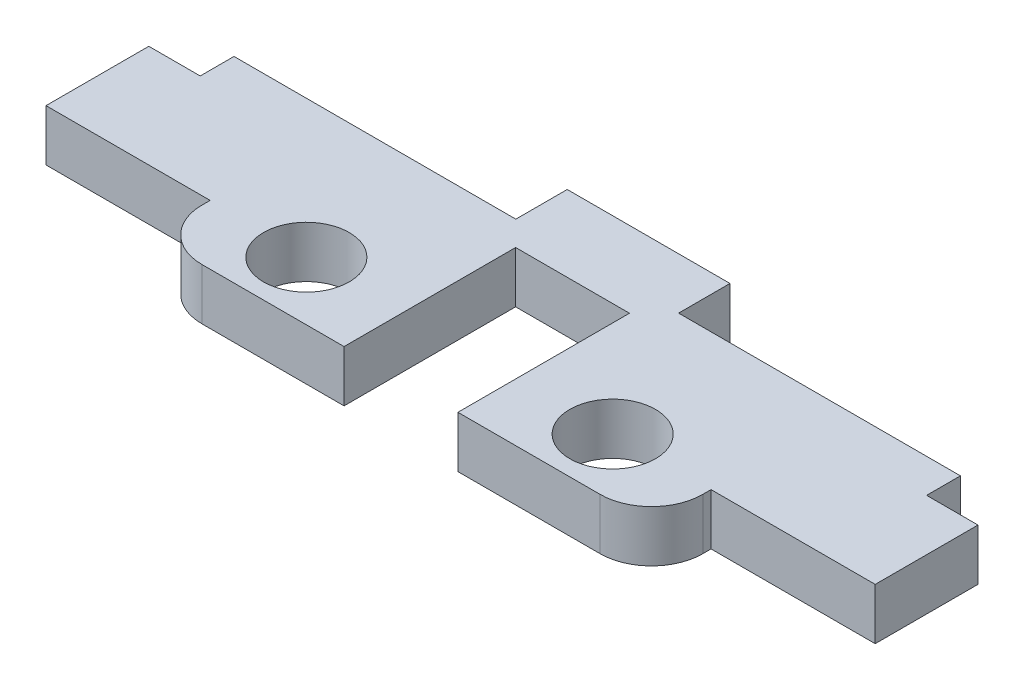
from build123d import *

# Parameters (mm, degrees)
SKETCH1_R           = 5
BOSS_EXTRUDE1_DEPTH = 6


with BuildPart() as part:
    # Sketch1 → Boss-Extrude1 (new body)
    with BuildSketch(Plane(origin=(0, 0, 0), x_dir=(1, 0, 0), z_dir=(0, 1, 0))):
        with BuildLine():
            Line((17.615827491, 6.405693798), (17.615827491, 7.364453077))
            Line((17.615827491, 7.364453077), (-1.545270838, 7.364453077))
            Line((-1.545270838, 7.364453077), (-1.545270838, 19.364453077))
            Line((-1.545270838, 19.364453077), (4.454729162, 19.364453077))
            Line((4.454729162, 19.364453077), (4.454729162, 23.311113477))
            Line((4.454729162, 23.311113477), (37.351818757, 23.311113477))
            Line((37.351818757, 23.311113477), (37.351818757, 29.311113477))
            Line((37.351818757, 29.311113477), (56.351818757, 29.311113477))
            Line((56.351818757, 29.311113477), (56.351818757, 23.311113477))
            Line((56.351818757, 23.311113477), (89.248908352, 23.311113477))
            Line((89.248908352, 23.311113477), (89.248908352, 19.364453077))
            Line((89.248908352, 19.364453077), (95.248908352, 19.364453077))
            Line((95.248908352, 19.364453077), (95.248908352, 7.364453077))
            Line((95.248908352, 7.364453077), (76.087810024, 7.364453077))
            Line((76.087810024, 7.364453077), (76.087810024, 6.405693798))
            ThreePointArc((76.087810024, 6.405693798), (74.330450711, 2.163053111), (70.087810024, 0.405693798))
            Line((70.087810024, 0.405693798), (53.496778433, 0.405693798))
            Line((53.496778433, 0.405693798), (53.496778433, 20.432362651))
            Line((53.496778433, 20.432362651), (40.206859082, 20.432362651))
            Line((40.206859082, 20.432362651), (40.206859082, 0.405693798))
            Line((40.206859082, 0.405693798), (23.615827491, 0.405693798))
            ThreePointArc((23.615827491, 0.405693798), (19.373186804, 2.163053111), (17.615827491, 6.405693798))
        make_face()
        with Locations(Location((28.974519722, 7.237839647, 0), (0, 0, 270))):
            Circle(SKETCH1_R, mode=Mode.SUBTRACT)
        with Locations(Location((64.729117792, 7.237839647, 0), (0, 0, 270))):
            Circle(SKETCH1_R, mode=Mode.SUBTRACT)
    extrude(amount=BOSS_EXTRUDE1_DEPTH)


solid = part.part
